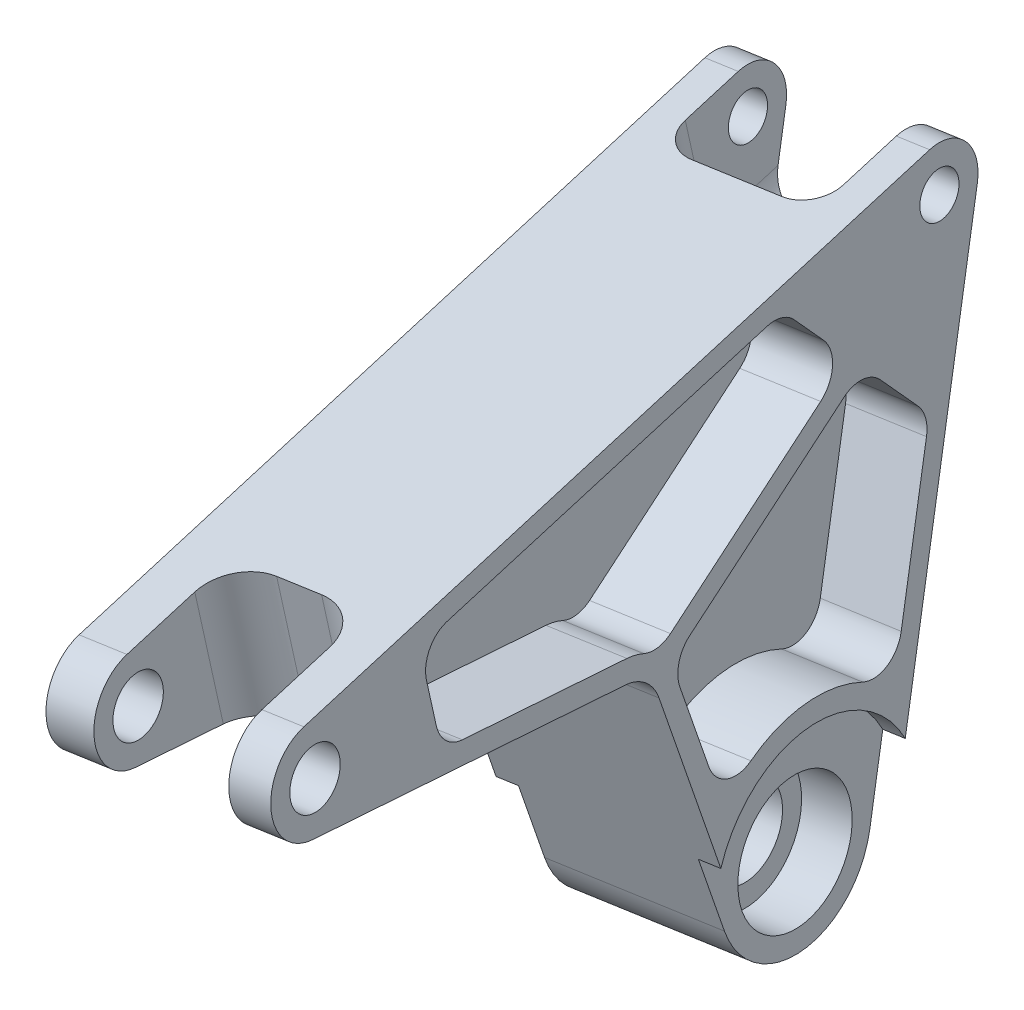
from build123d import *

# Parameters (mm, degrees)
SKETCH1_R               = 3.263900000000121
SKETCH1_R_2             = 4.199999999999976
BOSS_EXTRUDE1_DEPTH     = 15.875
FILLET7_R               = 6.35
CUT_EXTRUDE6_DEPTH      = 25.4
FILLET8_R               = 6.35
CUT_EXTRUDE8_DEPTH      = 20.32
CUT_EXTRUDE9_DEPTH      = 906.5663752758251
CUT_EXTRUDE9_DEPTH_BACK = 3.175
CUT_EXTRUDE10_DEPTH     = 11.43
SKETCH29_R              = 6.349999999999941
CUT_EXTRUDE11_DEPTH     = 906.4543212392226
SKETCH30_R              = 9.525000000000018
CUT_EXTRUDE12_DEPTH     = 7.14375
FILLET10_R              = 4.7625
FILLET10_OF_MIRROR9_R   = 4.7625
SKETCH33_R              = 17.144999999999648
CUT_EXTRUDE14_DEPTH     = 3.175
FILLET11_R              = 4.7625


with BuildPart() as part:
    # Sketch1 → Boss-Extrude1 (new, symmetric)
    with BuildSketch(Plane(origin=(-803.6566332789141, -58.26345281012812, 68.82567852426239), x_dir=(-0.08515417095162939, -0.00241614660156225, -0.9963648575723355), z_dir=(0.9937636896807375, 0.07204582335356381, -0.08510657089457987))):
        with BuildLine():
            ThreePointArc((-664.2038450226969, 436.8184776127322), (-651.8745198787159, 427.9178662715624), (-639.8468613838354, 437.2220896073974))
            Line((-639.8468613838348, 437.2220896073972), (-619.5515204929051, 510.40226291213133))
            ThreePointArc((-619.5515204929051, 510.40226291213133), (-620.9838530756886, 516.4455246988489), (-626.8562553144544, 518.4672768094307))
            Line((-626.8562553144544, 518.4672768094307), (-733.0342996841451, 500.0570320892499))
            ThreePointArc((-733.0342996841451, 500.05703208924996), (-739.1483230926673, 492.6676503574812), (-732.7916358037484, 485.48595339028384))
            Line((-732.7916358037484, 485.4859533902838), (-677.0205822251494, 477.71877799538424))
            Line((-677.0205822251494, 477.71877799538424), (-664.2038450226976, 436.81847761273195))
        make_face()
        with Locations(Location((-625.7562257117465, 512.1230378414245, 0), (0, 0, 0.138795824))):
            Circle(SKETCH1_R, mode=Mode.SUBTRACT)
        with Locations(Location((-731.7743456050367, 492.79045512904787, 0), (0, 0, 0.138795824))):
            Circle(SKETCH1_R_2, mode=Mode.SUBTRACT)
    extrude(amount=BOSS_EXTRUDE1_DEPTH, both=True)

    # Fillet7
    fillet7_edges = [part.edges().sort_by_distance(p)[0] for p in [
        (-780.3962698306742, 419.8482713749311, 745.1689599242694),
    ]]
    fillet(fillet7_edges, radius=FILLET7_R)

    # Sketch23 → Cut-Extrude6 (cut)
    with BuildSketch(Plane(origin=(61.972947811989165, -108.2363846344534, 632.0133130126799), x_dir=(0.9953619214294605, 0.016238085990304504, -0.09482072522199067), z_dir=(0.09620106739496219, -0.16801614414720037, 0.9810789621319872))):
        Polygon((-851.4974580179244, 570.6197226277428), (-849.4828619685262, 535.112578894877), (-830.4634507696352, 536.1916978167321), (-832.4780468190336, 571.698841549598), align=None)
    extrude(amount=-CUT_EXTRUDE6_DEPTH, mode=Mode.SUBTRACT)

    # Fillet8
    fillet8_edges = [part.edges().sort_by_distance(p)[0] for p in [
        (-768.4981336258412, 435.7374633830816, 780.7155057686616),
        (-787.4293319142591, 434.3649904481962, 782.3367859442033),
    ]]
    fillet(fillet8_edges, radius=FILLET8_R)

    # Sketch26 → Cut-Extrude8 (cut)
    with BuildSketch(Plane(origin=(50.277187193507835, -87.80961957666034, 512.7374567291475), x_dir=(-0.9953619214296225, -0.01623864853432569, 0.09482062888268945), z_dir=(-0.0962010673949623, 0.16801614414720273, -0.9810789621319869))):
        Polygon((831.6096354550859, 577.9339524783938), (830.1087716603103, 551.4810443146557), (852.3995223072293, 550.2163296603253), (853.9003861020049, 576.6692378240637), align=None)
    extrude(amount=-CUT_EXTRUDE8_DEPTH, mode=Mode.SUBTRACT)

    # Sketch27 → Cut-Extrude9 (cut, two sides: drawn at the far end of the back side and taken through both)
    with BuildSketch(Plane(origin=(-819.4326318525958, -59.40718025586634, 70.17674533721406), x_dir=(0.08488379068765259, 0.006153900220914947, 0.9963718540738522), z_dir=(-0.9937636896807374, -0.07204582335356426, 0.08510657089458012)).offset(-CUT_EXTRUDE9_DEPTH_BACK)):
        with BuildLine():
            Line((519.6219025840122, 211.91880941976535), (638.4443725730704, 445.9315686732567))
            ThreePointArc((638.4443725730704, 445.9315686732567), (654.0798834896251, 455.31078922151056), (669.3214837157453, 445.3041613048935))
            Line((669.3214837157453, 445.3041613048935), (778.5397566596026, 206.65772885116039))
            Line((778.5397566596026, 206.65772885116039), (767.8761958936219, -318.1367946937436))
            Line((767.8761958936219, -318.1367946937436), (508.95834181803144, -312.87571412513864))
            Line((508.95834181803144, -312.87571412513864), (519.6219025840122, 211.91880941976535))
        make_face()
    extrude(amount=CUT_EXTRUDE9_DEPTH + CUT_EXTRUDE9_DEPTH_BACK, mode=Mode.SUBTRACT)

    # Sketch28 → Cut-Extrude10 (cut)
    with BuildSketch(Plane(origin=(-819.4326318525959, -59.40718025586635, 70.17674533721406), x_dir=(0.08488379068765257, 0.006153900220914946, 0.9963718540738522), z_dir=(-0.9937636896807375, -0.07204582335356424, 0.08510657089458012))):
        with BuildLine():
            Line((641.610435680991, 494.9044603779857), (631.4071387526498, 483.7236998843152))
            Line((631.4071387526498, 483.7236998843152), (639.8115098751724, 452.97250675062605))
            ThreePointArc((639.8115098751724, 452.97250675062605), (654.1443845784224, 458.48513397429696), (668.241493429274, 452.3948237840471))
            Line((668.2414934292741, 452.39482378404716), (674.5635114397776, 472.307585723845))
            ThreePointArc((674.5635114397776, 472.307585723845), (674.9689897543286, 473.36298990652836), (675.4966669350005, 474.3629136263164))
            Line((675.4966669350005, 474.3629136263164), (641.6104356809909, 494.90446037798574))
        make_face()
        with BuildLine():
            Line((653.9539402363619, 508.43045781346063), (643.7918856391113, 497.29489061656125))
            Line((643.7918856391113, 497.2948906165613), (677.6083716229516, 476.79562285771186))
            ThreePointArc((677.6083716229516, 476.79562285771186), (679.842443438827, 478.15968717889757), (682.3634605019174, 478.8641169613652))
            Line((682.3634605019174, 478.8641169613652), (713.0233309253331, 483.01701779228154))
            Line((713.0233309253331, 483.0170177922816), (715.5913760089414, 497.50503494976147))
            Line((715.5913760089414, 497.50503494976147), (653.9539402363619, 508.4304578134607))
        make_face()
    cut_extrude10 = extrude(amount=-CUT_EXTRUDE10_DEPTH, mode=Mode.SUBTRACT)

    # Sketch29 → Cut-Extrude11 (cut, through all)
    with BuildSketch(Plane(origin=(-816.2774321378597, -59.1784347667188, 69.90653197462377), x_dir=(0.08488379068765259, 0.006153900220914947, 0.9963718540738522), z_dir=(-0.9937636896807374, -0.07204582335356423, 0.08510657089458012))):
        with Locations(Location((653.7315776101187, 438.16932755646275, 0), (0, 0, 359.646486586))):
            Circle(SKETCH29_R)
    extrude(amount=-CUT_EXTRUDE11_DEPTH, mode=Mode.SUBTRACT)

    # Sketch30 → Cut-Extrude12 (cut)
    with BuildSketch(Plane(origin=(-816.2774321378599, -59.178434766718816, 69.90653197462377), x_dir=(0.08488379068765257, 0.006153900220914946, 0.9963718540738522), z_dir=(-0.9937636896807375, -0.07204582335356424, 0.08510657089458012))):
        with Locations(Location((653.7315776101187, 438.16932755646275, 0), (0, 0, 359.646486586))):
            Circle(SKETCH30_R)
    cut_extrude12 = extrude(amount=-CUT_EXTRUDE12_DEPTH, mode=Mode.SUBTRACT)

    # Fillet10
    fillet10_edges = [part.edges().sort_by_distance(p)[0] for p in [
        (-788.1552248280682, 427.1450787260482, 780.1267395165396),
        (-788.9848414044336, 441.61097464981503, 782.6854673578397),
        (-795.0068579123044, 452.1284878234392, 721.2716611967566),
        (-795.0642591647301, 440.95953350372866, 711.1464760164944),
        (-790.7115231509628, 420.72202917254344, 744.8402708544758),
        (-789.7422422016995, 396.3274603010962, 735.5073770617572),
        (-792.1972581719219, 396.7286758070525, 707.180541636668),
        (-790.7148679020396, 418.2826927308667, 742.7362277392854),
        (-795.0765812752346, 438.5619361773402, 708.9729406771527),
        (-795.1342154885674, 427.347653060428, 698.8066627989953),
    ]]
    fillet(fillet10_edges, radius=FILLET10_R)

    # Mirror9: Cut-Extrude10, Cut-Extrude12 across plane
    add(cut_extrude10.mirror(Plane(origin=(-803.6566332789141, -58.26345281012812, 68.82567852426239), x_dir=(0.08488379068765235, 0.00615390022091489, 0.9963718540738523), z_dir=(0.9937636896807375, 0.07204582335356381, -0.08510657089457987))), mode=Mode.SUBTRACT)
    add(cut_extrude12.mirror(Plane(origin=(-803.6566332789141, -58.26345281012812, 68.82567852426239), x_dir=(0.08488379068765235, 0.00615390022091489, 0.9963718540738523), z_dir=(0.9937636896807375, 0.07204582335356381, -0.08510657089457987))), mode=Mode.SUBTRACT)

    # Fillet10 of Mirror9
    fillet10_of_mirror9_edges = [part.edges().sort_by_distance(p)[0] for p in [
        (-767.9619466537554, 428.60904985659255, 778.3973739959619),
        (-768.7915632301208, 443.0749457803594, 780.9561018372618),
        (-774.8135797379914, 453.59245895398357, 719.5422956761787),
        (-774.870980990417, 442.4235046342731, 709.4171104959165),
        (-770.5182449766497, 422.18600030308784, 743.1109053338979),
        (-769.5489640273865, 397.79143143164066, 733.7780115411794),
        (-772.0039799976088, 398.192646937597, 705.4511761160901),
        (-770.5215897277267, 419.74666386141104, 741.0068622187075),
        (-774.8833031009216, 440.02590730788467, 707.2435751565748),
        (-774.9409373142544, 428.8116241909724, 697.0772972784174),
    ]]
    fillet(fillet10_of_mirror9_edges, radius=FILLET10_OF_MIRROR9_R)

    # Sketch33 → Cut-Extrude14 (cut)
    with BuildSketch(Plane(origin=(-787.8806347052326, -57.119725364390696, 67.47461171131114), x_dir=(-0.08488379068765259, -0.006153900220914947, -0.9963718540738522), z_dir=(0.9937636896807374, 0.07204582335356423, -0.08510657089458012))):
        with Locations((-653.7315776101188, 438.1693275564627)):
            Circle(SKETCH33_R)
    extrude(amount=-CUT_EXTRUDE14_DEPTH, mode=Mode.SUBTRACT)

    # Fillet11
    fillet11_edges = [part.edges().sort_by_distance(p)[0] for p in [
        (-796.9082546128618, 438.46793345177383, 699.2942172907788),
        (-785.1203512694295, 438.0597382877858, 705.4239621272485),
        (-796.7868884418211, 447.2442527490892, 708.1408484710828),
        (-774.5995240477952, 448.852791028775, 706.240708105348),
        (-774.720890218836, 440.07647173145955, 697.3940769250439),
    ]]
    fillet(fillet11_edges, radius=FILLET11_R)


solid = part.part
